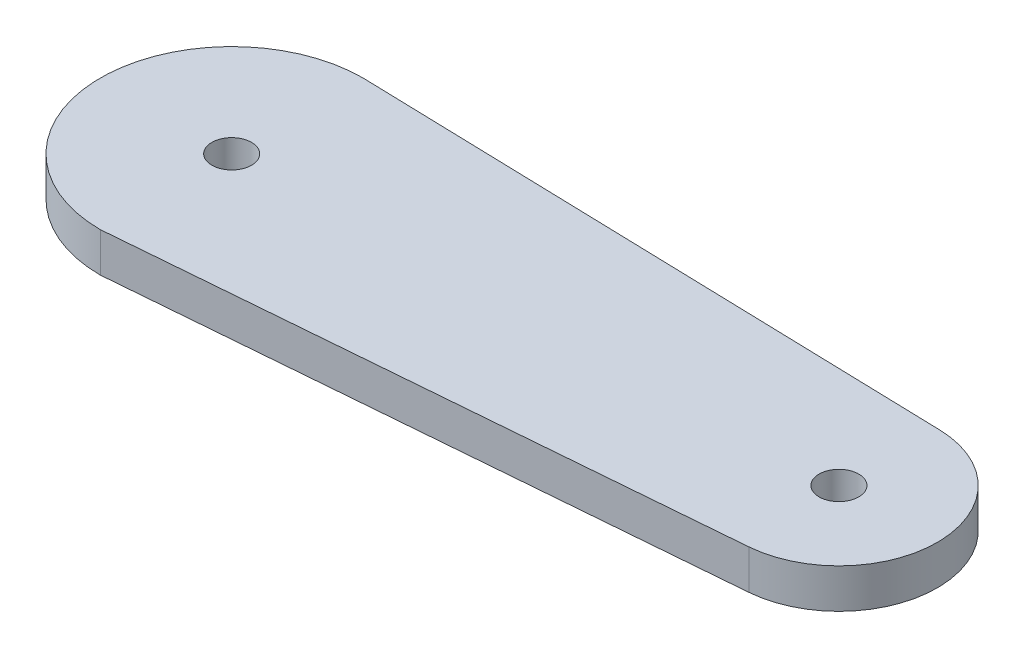
from build123d import *

# Parameters (mm, degrees)
BOSS_EXTRUDE1_DEPTH = 3
CUT_EXTRUDE1_REACH  = 55.511
SKETCH2_R           = 1.51


with BuildPart() as part:
    # Sketch1 → Boss-Extrude1 (new body)
    with BuildSketch(Plane(origin=(0, 0, 0), x_dir=(1, 0, 0), z_dir=(0, 1, 0))):
        with BuildLine():
            ThreePointArc((0, 10), (-10, 0), (0, -10))
            Line((0, -10), (45.601011206, -6.227938292))
            ThreePointArc((45.601011206, -6.227938292), (52.479923025, 1.451771759), (45.191159304, 8.743636932))
            Line((45.191159304, 8.743636932), (0, 10))
        make_face()
    extrude(amount=BOSS_EXTRUDE1_DEPTH)

    # Sketch2 → Cut-Extrude1 (cut, up to next)
    with BuildSketch(Plane(origin=(0, 3, 0), x_dir=(1, 0, 0), z_dir=(0, 1, 0)), mode=Mode.PRIVATE) as cut_extrude1_sk1:
        with Locations(Location((0, 0, 0), (0, 0, 270))):
            Circle(SKETCH2_R)
    cut_extrude1_tool1 = extrude(cut_extrude1_sk1.sketch, amount=-CUT_EXTRUDE1_REACH, mode=Mode.PRIVATE) & part.part
    # Sketch2 → Cut-Extrude1 (cut, up to next)
    with BuildSketch(Plane(origin=(0, 3, 0), x_dir=(1, 0, 0), z_dir=(0, 1, 0)), mode=Mode.PRIVATE) as cut_extrude1_sk2:
        with Locations(Location((44.98273173, 1.246533628, 0), (0, 0, 270))):
            Circle(SKETCH2_R)
    cut_extrude1_tool2 = extrude(cut_extrude1_sk2.sketch, amount=-CUT_EXTRUDE1_REACH, mode=Mode.PRIVATE) & part.part
    add(cut_extrude1_tool1.solids().sort_by_distance((0, 3, 0))[0], mode=Mode.SUBTRACT)
    add(cut_extrude1_tool2.solids().sort_by_distance((44.982732, 3, -1.246534))[0], mode=Mode.SUBTRACT)


solid = part.part
